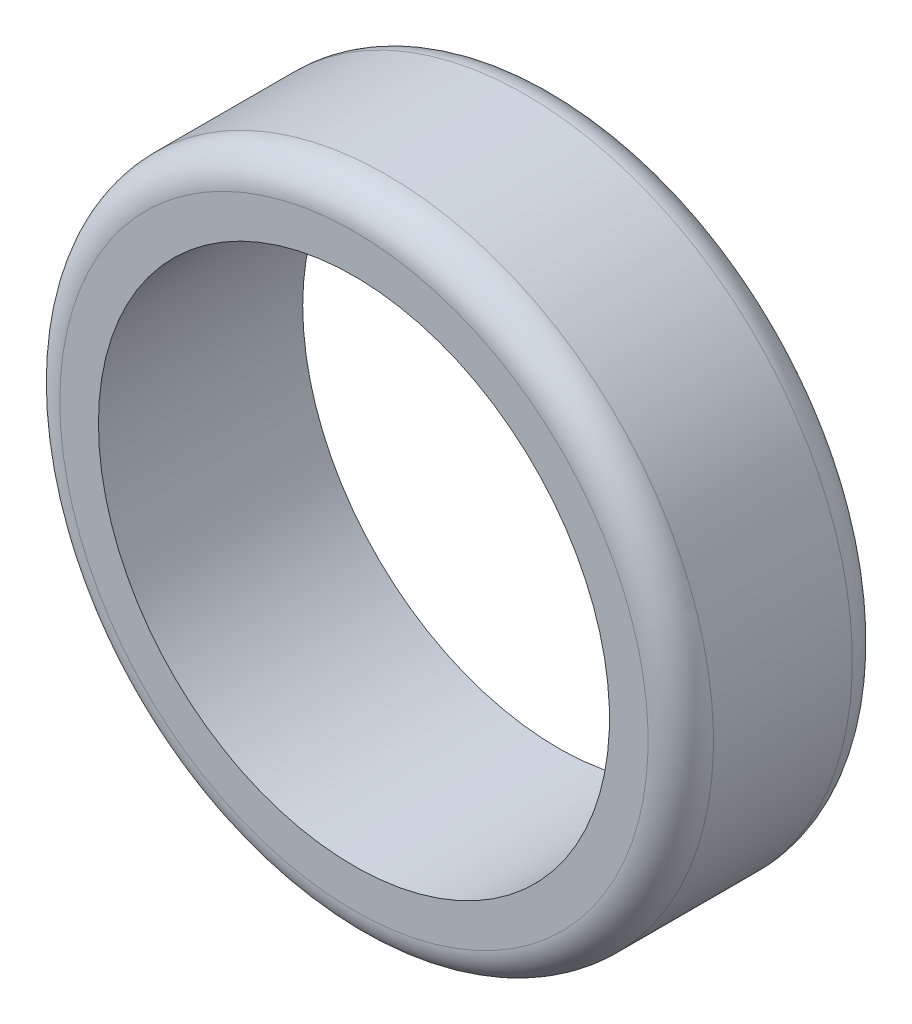
from build123d import *


with BuildPart() as part:
    # Sk_tread_section → Rev_tread (revolve)
    with BuildSketch(Plane(origin=(0, -19.05, 0), x_dir=(1, 0, 0), z_dir=(0, 1, 0)), mode=Mode.PRIVATE) as rev_tread_sk:
        with BuildLine():
            Line((78.20025, 15.875), (84.201, 15.875))
            ThreePointArc((84.201, 15.875), (87.793102448, 14.387102448), (89.281, 10.795))
            Line((89.281, 10.795), (89.281, -10.795))
            ThreePointArc((89.281, -10.795), (87.793102448, -14.387102448), (84.201, -15.875))
            Line((84.201, -15.875), (78.20025, -15.875))
            Line((78.20025, -15.875), (78.20025, 15.875))
        make_face()
    revolve(rev_tread_sk.sketch.rotate(Axis((38.481, -19.05, -50.8), (0, 0, 1)), 180), axis=Axis((38.481, -19.05, -50.8), (0, 0, 1)))


solid = part.part
